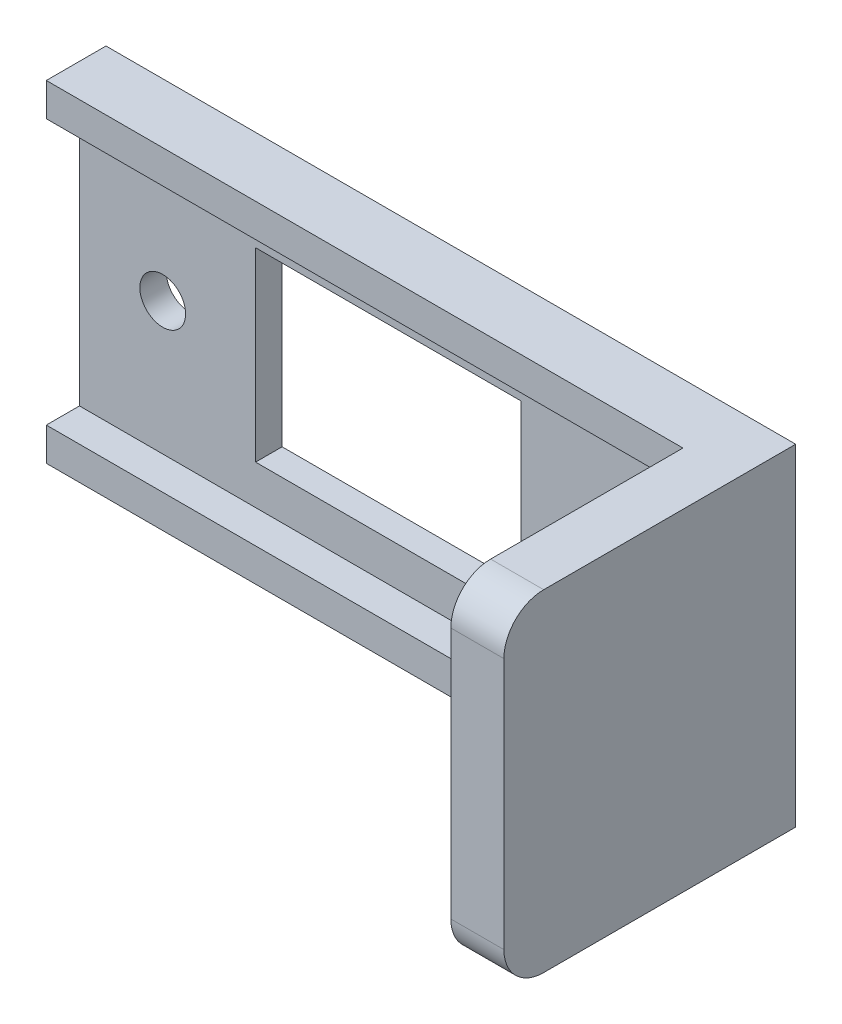
from build123d import *

# Parameters (mm, degrees)
SKETCH1_W           = 52
SKETCH1_H           = 25
BOSS_EXTRUDE1_DEPTH = 2
SKETCH2_W           = 4
SKETCH2_H           = 25
BOSS_EXTRUDE2_DEPTH = 20
FILLET1_R           = 3
SKETCH4_R           = 1.725
CUT_EXTRUDE2_DEPTH  = 2
SKETCH5_W           = 48
SKETCH5_H           = 2.5
BOSS_EXTRUDE3_DEPTH = 2.5
SKETCH6_W           = 20
SKETCH6_H           = 14
CUT_EXTRUDE3_DEPTH  = 2


with BuildPart() as part:
    # Sketch1 → Boss-Extrude1 (new body)
    with BuildSketch(Plane.XY):
        with Locations((26, -12.5)):
            Rectangle(SKETCH1_W, SKETCH1_H)
    extrude(amount=BOSS_EXTRUDE1_DEPTH)

    # Sketch2 → Boss-Extrude2 (add)
    with BuildSketch(Plane(origin=(0, 0, 2), x_dir=(-1, 0, 0), z_dir=(0, 0, -1))):
        with Locations((-50, -12.5)):
            Rectangle(SKETCH2_W, SKETCH2_H)
    extrude(amount=-BOSS_EXTRUDE2_DEPTH)

    # Fillet1
    fillet1_edges = [part.edges().sort_by_distance(p)[0] for p in [
        (50, -25, 22),
        (50, 0, 22),
    ]]
    fillet(fillet1_edges, radius=FILLET1_R)

    # Sketch4 → Cut-Extrude2 (cut)
    with BuildSketch(Plane.XY.offset(2)):
        with Locations((41.277695867, -12.5)):
            Circle(SKETCH4_R)
        with Locations((6.277695867, -12.5)):
            Circle(SKETCH4_R)
    extrude(amount=-CUT_EXTRUDE2_DEPTH, mode=Mode.SUBTRACT)

    # Sketch5 → Boss-Extrude3 (add)
    with BuildSketch(Plane(origin=(0, 0, 2), x_dir=(-1, 0, 0), z_dir=(0, 0, -1))):
        with Locations((-24, -23.75)):
            Rectangle(SKETCH5_W, SKETCH5_H)
        with Locations((-24, -1.25)):
            Rectangle(SKETCH5_W, SKETCH5_H)
    extrude(amount=-BOSS_EXTRUDE3_DEPTH)

    # Sketch6 → Cut-Extrude3 (cut)
    with BuildSketch(Plane.XY.offset(2)):
        with Locations((23.277695867, -12.531043961)):
            Rectangle(SKETCH6_W, SKETCH6_H)
    extrude(amount=-CUT_EXTRUDE3_DEPTH, mode=Mode.SUBTRACT)


solid = part.part
